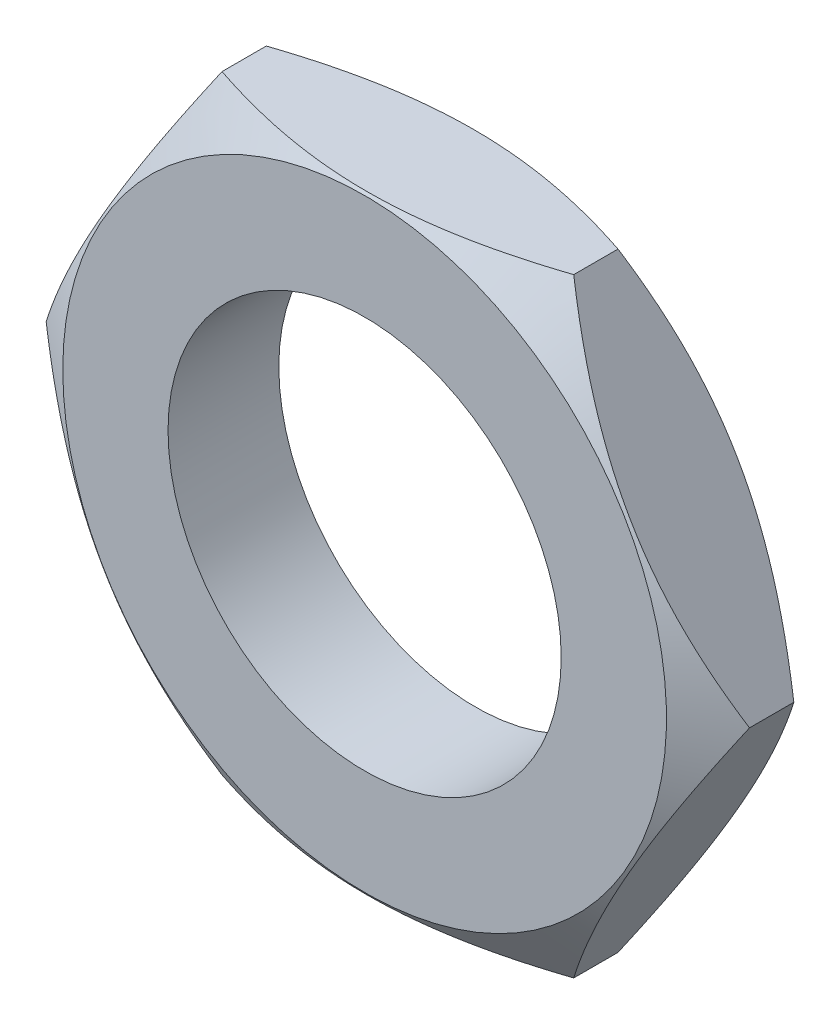
from build123d import *

# Parameters (mm, degrees)
ESQUISSE1_R        = 3.55
BOSS_EXTRU_1_DEPTH = 1


with BuildPart() as part:
    # Esquisse1 → Boss.-Extru.1 (new, symmetric)
    with BuildSketch(Plane.XY):
        Polygon((3.175426481, -5.5), (6.350852961, 0), (3.175426481, 5.5), (-3.175426481, 5.5), (-6.350852961, 0), (-3.175426481, -5.5), align=None)
        Circle(ESQUISSE1_R, mode=Mode.SUBTRACT)
    extrude(amount=BOSS_EXTRU_1_DEPTH, both=True)

    # Esquisse2 → Enlèvement de matière-Révolution1 (revolve, cut)
    with BuildSketch(Plane(origin=(0, 0, 0), x_dir=(1, 0, 0), z_dir=(0, 1, 0))):
        Polygon((-6.350852961, -0.4), (-5.450852961, -1), (-6.350852961, -1), align=None)
    enl_vement_de_mati_re_r_volution1 = revolve(axis=Axis((0, 0, -0.1), (0, 0, 1)), mode=Mode.SUBTRACT)

    # Symétrie2: Enlèvement de matière-Révolution1 across plane
    add(enl_vement_de_mati_re_r_volution1.mirror(Plane.XY), mode=Mode.SUBTRACT)


solid = part.part
